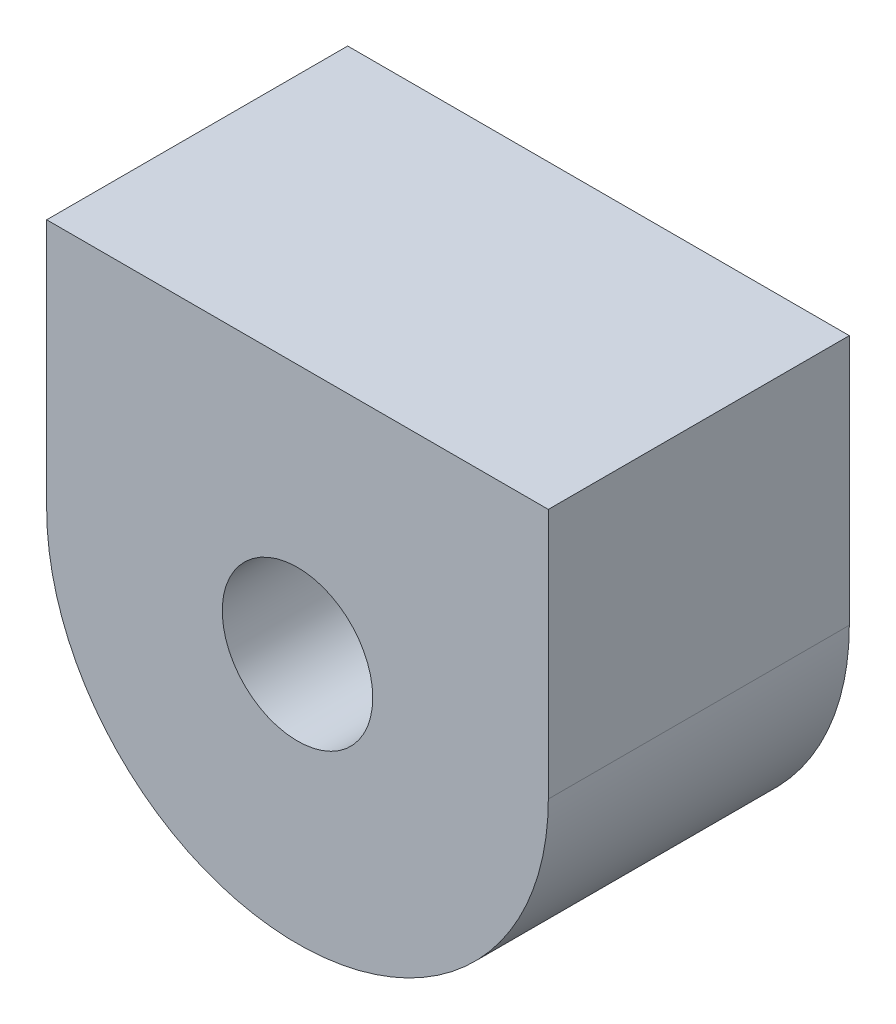
from build123d import *

# Parameters (mm, degrees)
SKETCH1_R           = 1.5
BOSS_EXTRUDE1_DEPTH = 6


with BuildPart() as part:
    # Sketch1 → Boss-Extrude1 (new body)
    with BuildSketch(Plane.XY):
        with BuildLine():
            Line((0, 0), (0, 5))
            Line((0, 5), (10, 5))
            Line((10, 5), (10, 0))
            ThreePointArc((10, 0), (5, -5), (0, 0))
        make_face()
        with Locations((5, 0)):
            Circle(SKETCH1_R, mode=Mode.SUBTRACT)
    extrude(amount=BOSS_EXTRUDE1_DEPTH)


solid = part.part
